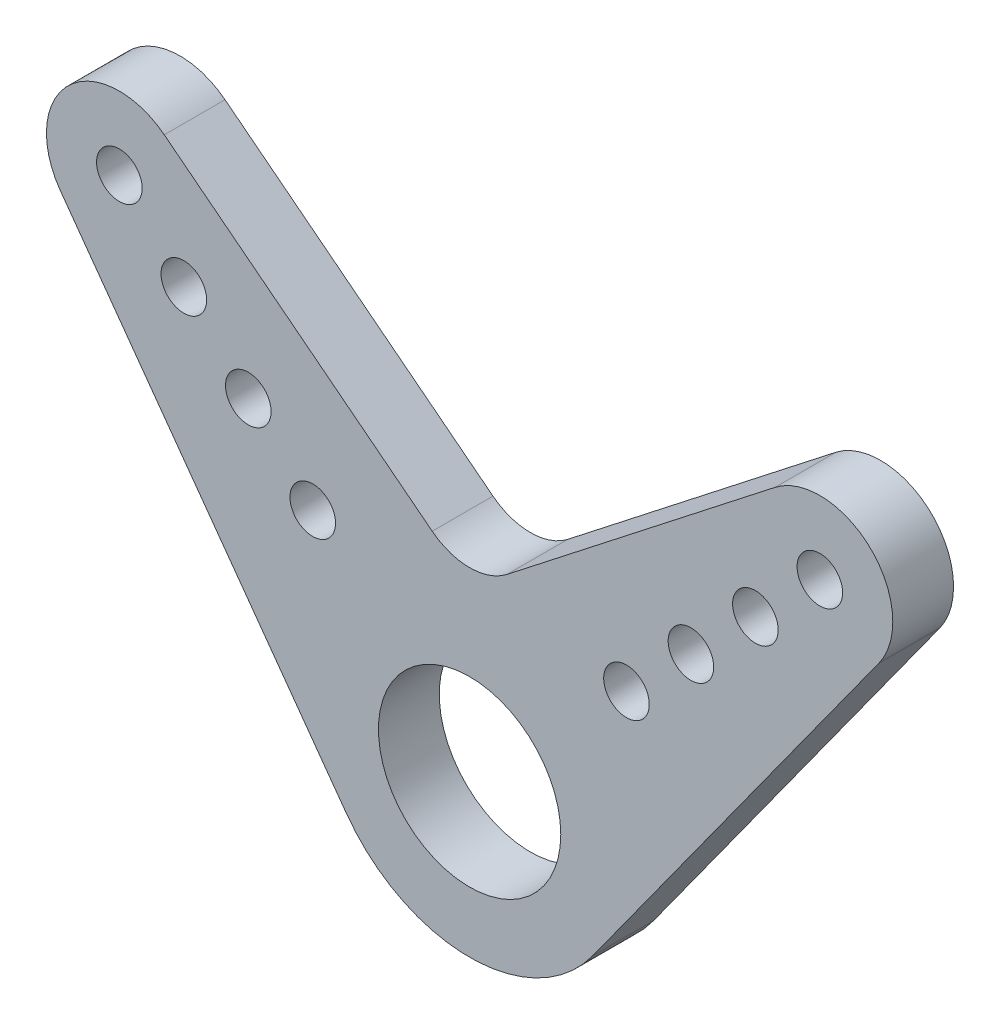
from build123d import *

# Parameters (mm, degrees)
SKETCH1_R      = 3
EXTRUDE1_DEPTH = 2
SKETCH2_R      = 0.75
EXTRUDE2_DEPTH = 2


with BuildPart() as part:
    # Sketch1 → Extrude1 (new body)
    with BuildSketch(Plane.XY):
        with BuildLine():
            Line((13.471864542, 10.121208711), (4.054216685, -2.926316298))
            ThreePointArc((4.054216685, -2.926316298), (0, -5), (-4.054216685, -2.926316298))
            Line((-4.054216685, -2.926316298), (-13.471864542, 10.121208711))
            ThreePointArc((-13.471864542, 10.121208711), (-13.190330714, 13.254849624), (-10.048252993, 13.417066342))
            Line((-10.048252993, 13.417066342), (-1.231322951, 6.52852563))
            ThreePointArc((-1.231322951, 6.52852563), (0, 6.104547138), (1.231322951, 6.52852563))
            Line((1.231322951, 6.52852563), (10.048252993, 13.417066342))
            ThreePointArc((10.048252993, 13.417066342), (13.190330714, 13.254849624), (13.471864542, 10.121208711))
        make_face()
        Circle(SKETCH1_R, mode=Mode.SUBTRACT)
    extrude(amount=EXTRUDE1_DEPTH)

    # Sketch2 → Extrude2 (cut)
    with BuildSketch(Plane.XY.offset(2)):
        with Locations((11.525840533, 11.525840533)):
            Circle(SKETCH2_R)
        with Locations((9.40452019, 9.40452019)):
            Circle(SKETCH2_R)
        with Locations((7.283199846, 7.283199846)):
            Circle(SKETCH2_R)
        with Locations((5.161879503, 5.161879503)):
            Circle(SKETCH2_R)
        with Locations(Location((-5.161879503, 5.161879503, 0), (0, 0, 180))):
            Circle(SKETCH2_R)
        with Locations(Location((-7.283199846, 7.283199846, 0), (0, 0, 180))):
            Circle(SKETCH2_R)
        with Locations(Location((-9.40452019, 9.40452019, 0), (0, 0, 180))):
            Circle(SKETCH2_R)
        with Locations(Location((-11.525840533, 11.525840533, 0), (0, 0, 180))):
            Circle(SKETCH2_R)
    extrude(amount=-EXTRUDE2_DEPTH, mode=Mode.SUBTRACT)


solid = part.part
